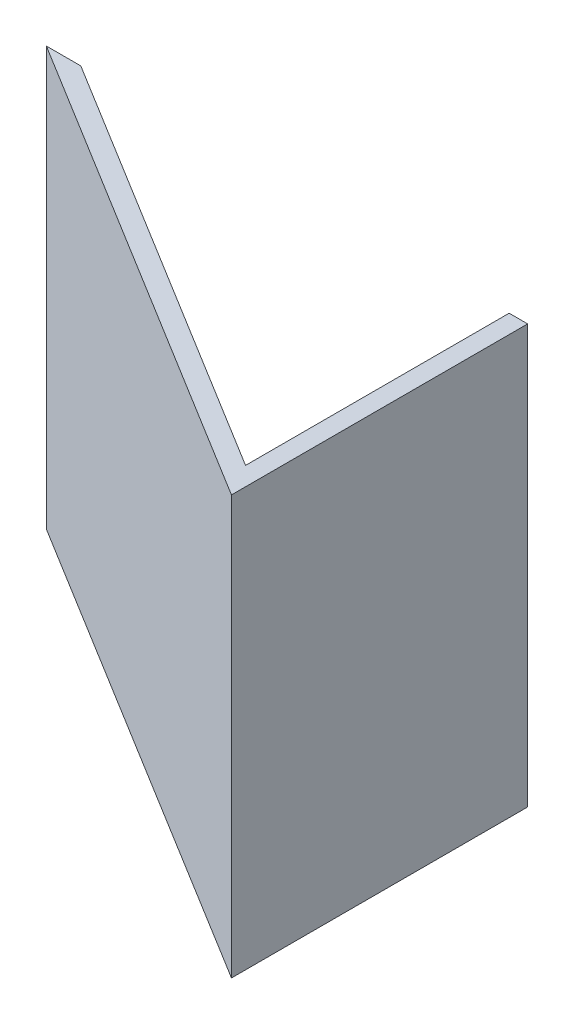
from build123d import *

# Parameters (mm, degrees)
BOSS_EXTRUDE1_DEPTH = 71.755


with BuildPart() as part:
    # Sketch1 → Boss-Extrude1 (new body)
    with BuildSketch(Plane(origin=(0, 0, 0), x_dir=(1, 0, 0), z_dir=(0, 1, 0))):
        Polygon((65.027116768, 34.190845126), (65.027116768, -16.609154874), (-17.522883232, 34.190845126), (-11.615430399, 34.190845126), (-10.94324946, 33.777195317), (61.59756304, -10.863304683), (61.852116768, -11.019953131), (61.852116768, -10.259154874), (61.852116768, 34.190845126), align=None)
    extrude(amount=BOSS_EXTRUDE1_DEPTH)


solid = part.part
